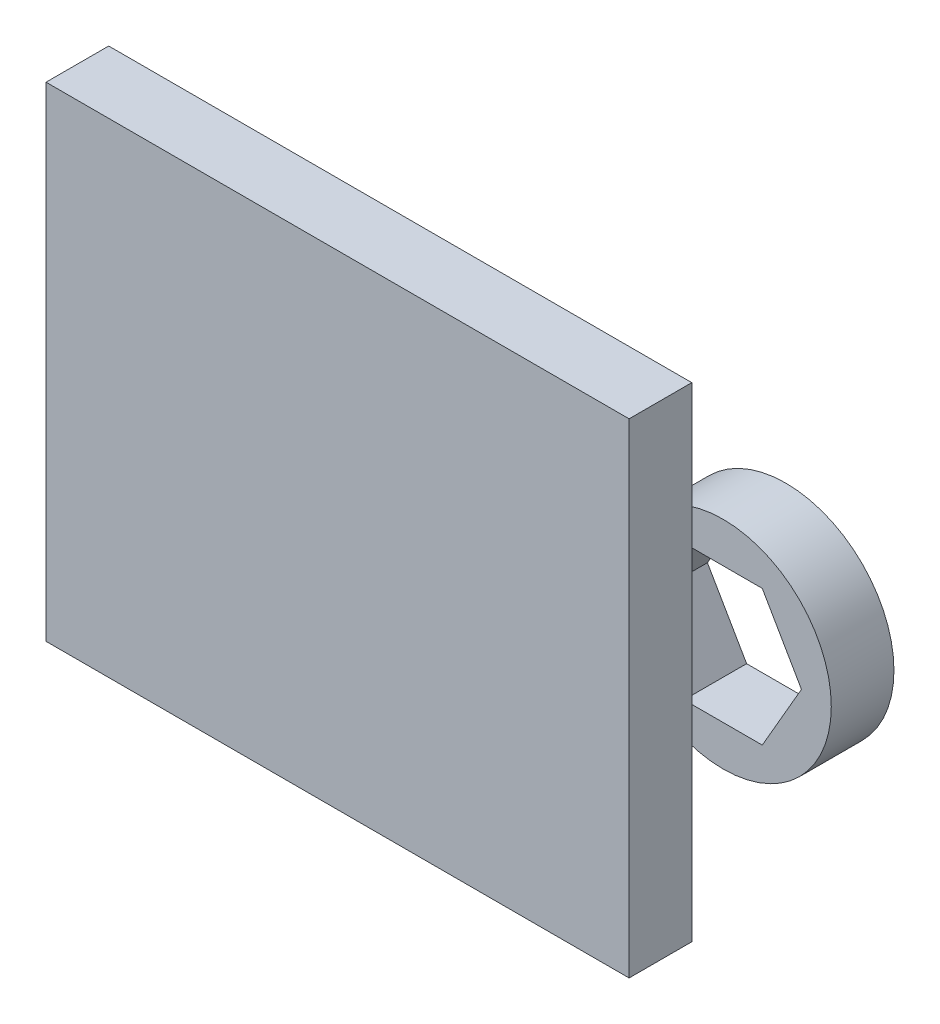
from build123d import *

# Parameters (mm, degrees)
F_1_FR_W                       = 93.042145165
F_1_FR_H                       = 77.277529207
EXTRUDE_1_DEPTH                = 10
SKETCH_5_R                     = 17.261773312
EXTRUDE_2_DEPTH                = 10
SPLIT_BODIES_1_SURFACE_1_BACK  = 137.981
SPLIT_BODIES_1_SURFACE_1_DEPTH = 275.962


with BuildPart() as part:
    # Эскиз1_fr → Бобышка-Вытянуть1 (new body)
    with BuildSketch(Plane.XY):
        with Locations((-2.472880935, -0.618220234)):
            Rectangle(F_1_FR_W, F_1_FR_H)
    extrude(amount=EXTRUDE_1_DEPTH)


with BuildPart() as body_2:
    # Эскиз5 → Бобышка-Вытянуть2 (new body)
    with BuildSketch(Plane.XY.offset(-5)):
        with Locations((44.048191648, -0.618220234)):
            Circle(SKETCH_5_R)
    extrude(amount=-EXTRUDE_2_DEPTH)

    # Split Bodies 1: cut with a surface, the side behind it stays
    # Split Bodies 1 surface: a surface, the sketch's curves swept straight by 275.962 mm
    with BuildLine(Plane.XY.offset(20).offset(-SPLIT_BODIES_1_SURFACE_1_BACK), mode=Mode.PRIVATE) as split_bodies_1_surface_1_path:
        Line((50.298388751, -11.443879173), (56.548585854, -0.618220234))
        Line((56.548585854, -0.618220234), (50.298388751, 10.207438706))
        Line((50.298388751, 10.207438706), (37.797994545, 10.207438706))
        Line((37.797994545, 10.207438706), (31.547797442, -0.618220234))
        Line((31.547797442, -0.618220234), (37.797994545, -11.443879173))
        Line((37.797994545, -11.443879173), (50.298388751, -11.443879173))
    split_bodies_1_surface_1 = Shell.extrude(split_bodies_1_surface_1_path.wire(), (0 * SPLIT_BODIES_1_SURFACE_1_DEPTH, 0 * SPLIT_BODIES_1_SURFACE_1_DEPTH, 1 * SPLIT_BODIES_1_SURFACE_1_DEPTH))
    split(bisect_by=split_bodies_1_surface_1, keep=Keep.BOTTOM)


solid = Compound([part.part, body_2.part])
